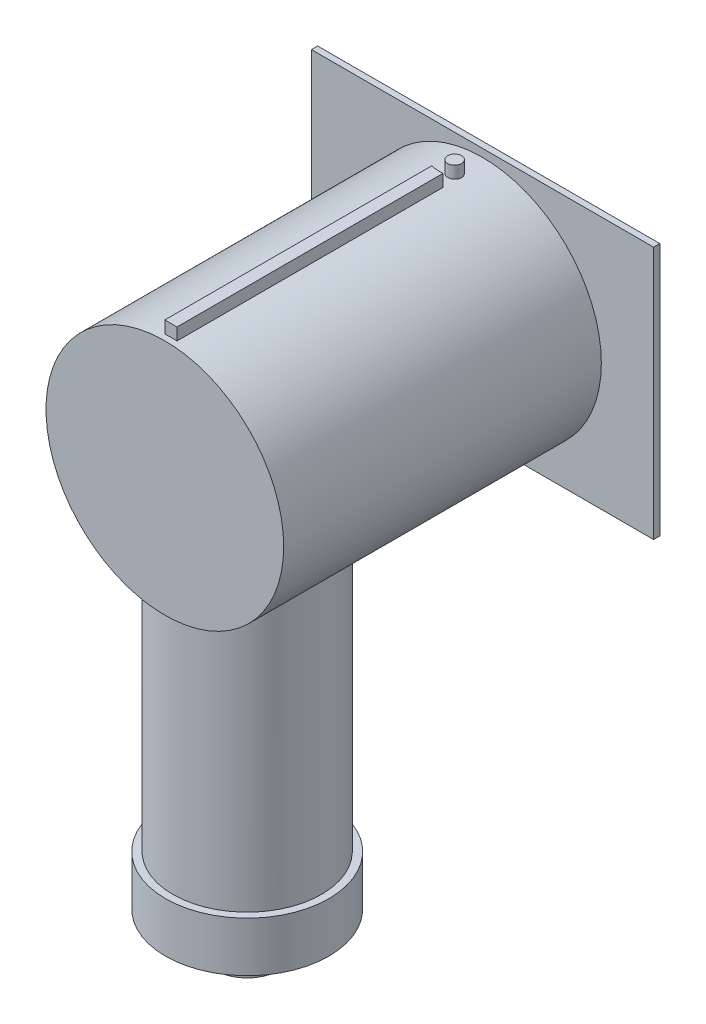
from build123d import *

# Parameters (mm, degrees)
SKETCH2_W           = 54.93072207
SKETCH2_H           = 40.655962058
BOSS_EXTRUDE1_DEPTH = 1
SKETCH3_R           = 19.076133807
BOSS_EXTRUDE2_DEPTH = 51
SKETCH4_R           = 11.934045709
BOSS_EXTRUDE3_DEPTH = 40
BOSS_EXTRUDE4_START = 10
SKETCH5_R           = 11.934045709
BOSS_EXTRUDE4_DEPTH = 10
SKETCH6_R           = 13.112340193
BOSS_EXTRUDE5_DEPTH = 8
SKETCH7_R           = 5.071080503
BOSS_EXTRUDE6_DEPTH = 6
SKETCH8_R           = 1.107443945
BOSS_EXTRUDE7_DEPTH = 2
SCALE1_SCALE        = 0.5
SCALE2_SCALE        = 0.5
SCALE3_SCALE        = 0.5


with BuildPart() as part:
    # Sketch2 → Boss-Extrude1 (new body)
    with BuildSketch(Plane.XY):
        Rectangle(SKETCH2_W, SKETCH2_H)
    extrude(amount=BOSS_EXTRUDE1_DEPTH)

    # Sketch3 → Boss-Extrude2 (add)
    with BuildSketch(Plane.XY.offset(1)):
        Circle(SKETCH3_R)
    extrude(amount=BOSS_EXTRUDE2_DEPTH)

    # Sketch4 → Boss-Extrude3 (add)
    with BuildSketch(Plane(origin=(0, -19, 0), x_dir=(1, 0, 0), z_dir=(0, 1, 0))):
        with Locations(Location((-0.455521122, -38.326598174, 0), (0, 0, 270))):
            Circle(SKETCH4_R)
    extrude(amount=-BOSS_EXTRUDE3_DEPTH)

    # Sketch5 → Boss-Extrude4 (add)
    with BuildSketch(Plane(origin=(0, -19, 0), x_dir=(1, 0, 0), z_dir=(0, 1, 0)).offset(BOSS_EXTRUDE4_START)):
        with Locations(Location((-0.455521122, -38.326598174, 0), (0, 0, 270))):
            Circle(SKETCH5_R)
    extrude(amount=-BOSS_EXTRUDE4_DEPTH)

    # Sketch6 → Boss-Extrude5 (add)
    with BuildSketch(Plane.XZ.offset(59)):
        with Locations(Location((-0.455521122, 38.326598174, 0), (0, 0, 270))):
            Circle(SKETCH6_R)
    extrude(amount=BOSS_EXTRUDE5_DEPTH)

    # Sketch7 → Boss-Extrude6 (add)
    with BuildSketch(Plane.XZ.offset(67)):
        with Locations(Location((-0.455521122, 38.326598174, 0), (0, 0, 270))):
            Circle(SKETCH7_R)
    extrude(amount=BOSS_EXTRUDE6_DEPTH)

    # Sketch8 → Boss-Extrude7 (add)
    with BuildSketch(Plane(origin=(0, 19, 0), x_dir=(1, 0, 0), z_dir=(0, 1, 0))):
        with BuildLine():
            add(Edge.make_bspline(
                [(-0.976975476, -8.151409565), (-0.015117663, -8.40988659), (0.976975476, -8.324614056)],
                knots=[0, 0, 0, 1, 1, 1], degree=2))
            Line((0.976975476, -8.324614056), (0.976975476, -51.031726638))
            Line((0.976975476, -51.031726638), (-0.976975476, -51.031726638))
            Line((-0.976975476, -51.031726638), (-0.976975476, -8.151409565))
        make_face()
        with Locations(Location((0, -5.474365912, 0), (0, 0, 90))):
            Circle(SKETCH8_R)
    extrude(amount=BOSS_EXTRUDE7_DEPTH)


with BuildPart() as part_1:
    # Scale1: scaled about (0, 0, 0)
    add(part.part.scale(SCALE1_SCALE))


with BuildPart() as part_2:
    # Scale2: scaled about (0, 0, 0)
    add(part_1.part.scale(SCALE2_SCALE))


with BuildPart() as part_3:
    # Scale3: scaled about (0, 0, 0)
    add(part_2.part.scale(SCALE3_SCALE))


solid = part_3.part
